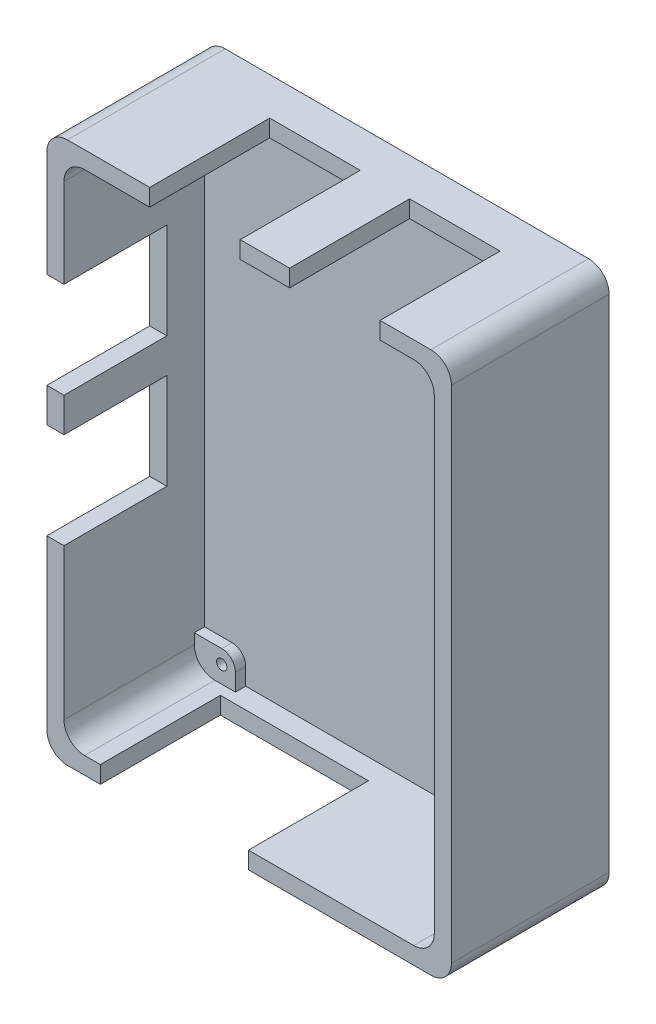
from build123d import *

# Parameters (mm, degrees)
EXTRUDE_1_DEPTH     = 2.5
SKETCH_1_5_R        = 0.75
EXTRUDE_3_DEPTH     = 1.5
SKETCH_1_6_W        = 13.2
SKETCH_1_6_H        = 2.5
SKETCH_1_6_W_2      = 21.6
EXTRUDE_4_DEPTH     = 3
SKETCH_1_7_W        = 2.5
SKETCH_1_7_H        = 14
EXTRUDE_5_DEPTH     = 5.5
SKETCH_1_8_W        = 7.2
SKETCH_1_8_H        = 2.5
SKETCH_1_8_W_2      = 2.5
SKETCH_1_8_H_2      = 5
EXTRUDE_6_DEPTH     = 20.5
CUT_EXTRUDE_START   = -1.4
SKETCH_1_9_R        = 0.75
CUT_EXTRUDE_1_DEPTH = 1.4


with BuildPart() as part:
    # 草图1 → 凸台-拉伸1 (new body)
    with BuildSketch(Plane.XY):
        with BuildLine():
            Line((-26.5, 39.5), (26.5, 39.5))
            ThreePointArc((26.5, 39.5), (28.621320344, 38.621320344), (29.5, 36.5))
            Line((29.5, 36.5), (29.5, -36.5))
            ThreePointArc((29.5, -36.5), (28.621320344, -38.621320344), (26.5, -39.5))
            Line((26.5, -39.5), (-26.5, -39.5))
            ThreePointArc((-26.5, -39.5), (-28.621320344, -38.621320344), (-29.5, -36.5))
            Line((-29.5, -36.5), (-29.5, 36.5))
            ThreePointArc((-29.5, 36.5), (-28.621320344, 38.621320344), (-26.5, 39.5))
        make_face()
    extrude(amount=-EXTRUDE_1_DEPTH)

    # 草图1<5> → 凸台-拉伸3 (add)
    # profile 1 of 4: a face of its own
    with BuildSketch(Plane.XY):
        with BuildLine():
            Line((-21, 31.5), (-21, 37))
            Line((-21, 37), (-24, 37))
            ThreePointArc((-24, 37), (-26.121320344, 36.121320344), (-27, 34))
            Line((-27, 34), (-27, 29.5))
            Line((-27, 29.5), (-23, 29.5))
            ThreePointArc((-23, 29.5), (-21.585786438, 30.085786438), (-21, 31.5))
        make_face()
        with Locations((-23, 31.5)):
            Circle(SKETCH_1_5_R, mode=Mode.SUBTRACT)
    # profile 2 of 4: a face of its own
    with BuildSketch(Plane.XY):
        with BuildLine():
            Line((24, 37), (21, 37))
            Line((21, 37), (21, 31.5))
            ThreePointArc((21, 31.5), (21.585786438, 30.085786438), (23, 29.5))
            Line((23, 29.5), (27, 29.5))
            Line((27, 29.5), (27, 34))
            ThreePointArc((27, 34), (26.121320344, 36.121320344), (24, 37))
        make_face()
        with Locations((23, 31.5)):
            Circle(SKETCH_1_5_R, mode=Mode.SUBTRACT)
    # profile 3 of 4: a face of its own
    with BuildSketch(Plane.XY):
        with BuildLine():
            Line((-23, -32.5), (-27, -32.5))
            Line((-27, -32.5), (-27, -34))
            ThreePointArc((-27, -34), (-26.121320344, -36.121320344), (-24, -37))
            Line((-24, -37), (-21, -37))
            Line((-21, -37), (-21, -34.5))
            ThreePointArc((-21, -34.5), (-21.585786438, -33.085786438), (-23, -32.5))
        make_face()
        with Locations((-23, -34.5)):
            Circle(SKETCH_1_5_R, mode=Mode.SUBTRACT)
    # profile 4 of 4: a face of its own
    with BuildSketch(Plane.XY):
        with BuildLine():
            Line((27, -34), (27, -32.5))
            Line((27, -32.5), (23, -32.5))
            ThreePointArc((23, -32.5), (21.585786438, -33.085786438), (21, -34.5))
            Line((21, -34.5), (21, -37))
            Line((21, -37), (24, -37))
            ThreePointArc((24, -37), (26.121320344, -36.121320344), (27, -34))
        make_face()
        with Locations((23, -34.5)):
            Circle(SKETCH_1_5_R, mode=Mode.SUBTRACT)
    extrude(amount=EXTRUDE_3_DEPTH)

    # 草图1<6> → 凸台-拉伸4 (add)
    with BuildSketch(Plane.XY):
        with Locations((-7.9, 38.25)):
            Rectangle(SKETCH_1_6_W, SKETCH_1_6_H)
        with Locations((12.5, 38.25)):
            Rectangle(SKETCH_1_6_W, SKETCH_1_6_H)
        with Locations((-10.9, -38.25)):
            Rectangle(SKETCH_1_6_W_2, SKETCH_1_6_H)
    extrude(amount=EXTRUDE_4_DEPTH)

    # 草图1<7> → 凸台-拉伸5 (add)
    with BuildSketch(Plane.XY):
        with Locations((-28.25, 14)):
            Rectangle(SKETCH_1_7_W, SKETCH_1_7_H)
        with Locations((-28.25, -5)):
            Rectangle(SKETCH_1_7_W, SKETCH_1_7_H)
    extrude(amount=EXTRUDE_5_DEPTH)

    # 草图1<8> → 凸台-拉伸6 (add)
    with BuildSketch(Plane.XY):
        with BuildLine():
            Line((-14.5, 39.5), (-26.5, 39.5))
            ThreePointArc((-26.5, 39.5), (-28.621320344, 38.621320344), (-29.5, 36.5))
            Line((-29.5, 36.5), (-29.5, 21))
            Line((-29.5, 21), (-27, 21))
            Line((-27, 21), (-27, 34))
            ThreePointArc((-27, 34), (-26.121320344, 36.121320344), (-24, 37))
            Line((-24, 37), (-14.5, 37))
            Line((-14.5, 37), (-14.5, 39.5))
        make_face()
        with Locations((2.3, 38.25)):
            Rectangle(SKETCH_1_8_W, SKETCH_1_8_H)
        with Locations((-28.25, 4.5)):
            Rectangle(SKETCH_1_8_W_2, SKETCH_1_8_H_2)
        with BuildLine():
            Line((26.5, 39.5), (19.1, 39.5))
            Line((19.1, 39.5), (19.1, 37))
            Line((19.1, 37), (24, 37))
            ThreePointArc((24, 37), (26.121320344, 36.121320344), (27, 34))
            Line((27, 34), (27, -34))
            ThreePointArc((27, -34), (26.121320344, -36.121320344), (24, -37))
            Line((24, -37), (-0.1, -37))
            Line((-0.1, -37), (-0.1, -39.5))
            Line((-0.1, -39.5), (26.5, -39.5))
            ThreePointArc((26.5, -39.5), (28.621320344, -38.621320344), (29.5, -36.5))
            Line((29.5, -36.5), (29.5, 36.5))
            ThreePointArc((29.5, 36.5), (28.621320344, 38.621320344), (26.5, 39.5))
        make_face()
        with BuildLine():
            Line((-27, -12), (-29.5, -12))
            Line((-29.5, -12), (-29.5, -36.5))
            ThreePointArc((-29.5, -36.5), (-28.621320344, -38.621320344), (-26.5, -39.5))
            Line((-26.5, -39.5), (-21.7, -39.5))
            Line((-21.7, -39.5), (-21.7, -37))
            Line((-21.7, -37), (-24, -37))
            ThreePointArc((-24, -37), (-26.121320344, -36.121320344), (-27, -34))
            Line((-27, -34), (-27, -12))
        make_face()
    extrude(amount=EXTRUDE_6_DEPTH)

    # 草图1<9> → 切除-拉伸1 (cut)
    with BuildSketch(Plane.XY.offset(CUT_EXTRUDE_START)):
        with Locations((-23, 31.5)):
            Circle(SKETCH_1_9_R)
        with Locations((23, 31.5)):
            Circle(SKETCH_1_9_R)
        with Locations((23, -34.5)):
            Circle(SKETCH_1_9_R)
        with Locations((-23, -34.5)):
            Circle(SKETCH_1_9_R)
    extrude(amount=CUT_EXTRUDE_1_DEPTH, mode=Mode.SUBTRACT)


solid = part.part
